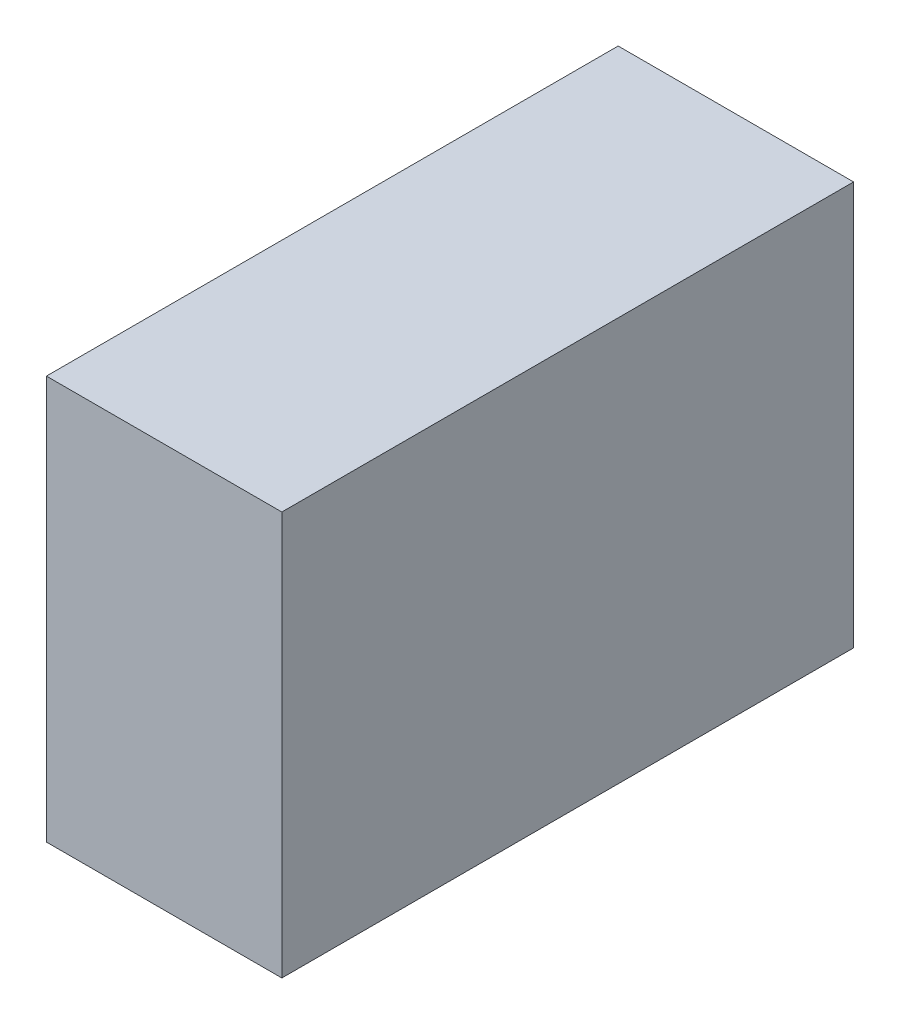
from build123d import *

# Parameters (mm, degrees)
SKETCH1_W           = 177.8
SKETCH1_H           = 304.8
BOSS_EXTRUDE1_DEPTH = 431.8


with BuildPart() as part:
    # Sketch1 → Boss-Extrude1 (new body)
    with BuildSketch(Plane.XY):
        Rectangle(SKETCH1_W, SKETCH1_H)
    extrude(amount=BOSS_EXTRUDE1_DEPTH)


solid = part.part
